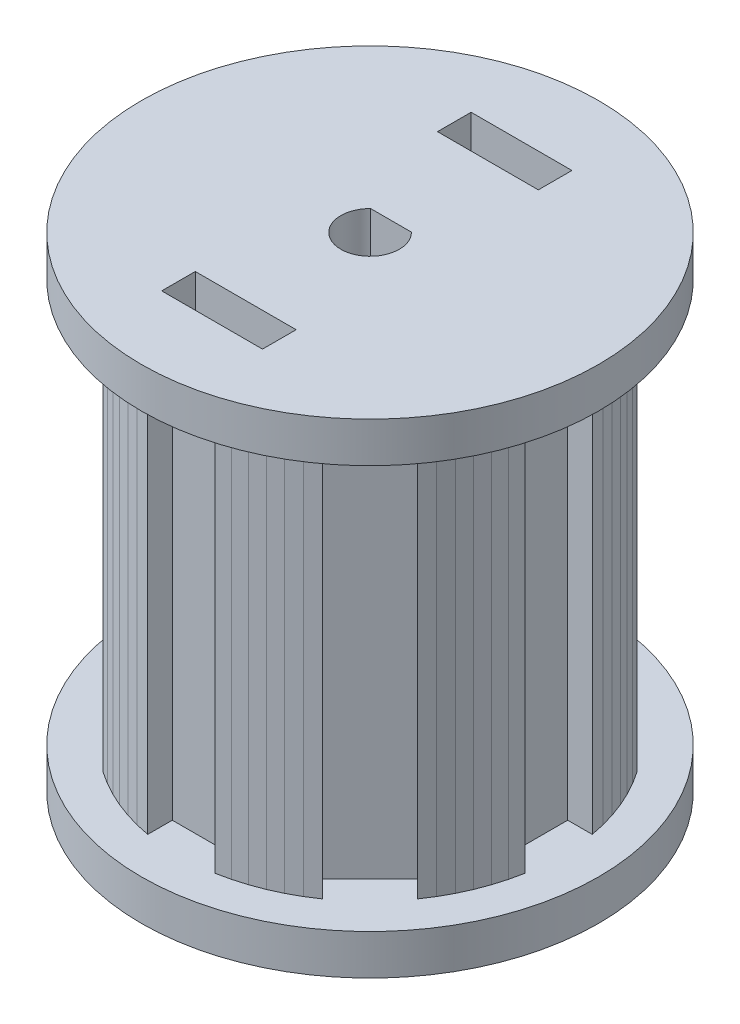
from build123d import *

# Parameters (mm, degrees)
SKETCH1_R           = 17
BOSS_EXTRUDE1_DEPTH = 3
SKETCH3_R           = 17
BOSS_EXTRUDE2_DEPTH = 3
BOSS_EXTRUDE3_DEPTH = 31
SKETCH7_R           = 1.751351815
CUT_EXTRUDE11_DEPTH = 50
CUT_EXTRUDE1_DEPTH  = 50
SKETCH8_W           = 7.5
SKETCH8_H           = 2.5
CUT_EXTRUDE12_DEPTH = 40


with BuildPart() as part:
    # Sketch1 → Boss-Extrude1 (new body)
    with BuildSketch(Plane(origin=(0, -15, 0), x_dir=(1, 0, 0), z_dir=(0, 1, 0))):
        with Locations(Location((0, 0, 0), (0, 0, 270))):
            Circle(SKETCH1_R)
    extrude(amount=BOSS_EXTRUDE1_DEPTH)



with BuildPart() as body_2:
    # Sketch3 → Boss-Extrude2 (new body)
    with BuildSketch(Plane(origin=(0, 21, 0), x_dir=(1, 0, 0), z_dir=(0, 1, 0))):
        with Locations(Location((0, 0, 0), (0, 0, 270))):
            Circle(SKETCH3_R)
    extrude(amount=-BOSS_EXTRUDE2_DEPTH)


with BuildPart() as part_1:
    add(part.part)

    add(body_2.part)  # Boss-Extrude3 merges body 2
    # Sketch6 → Boss-Extrude3 (add)
    with BuildSketch(Plane(origin=(0, -12, 0), x_dir=(1, 0, 0), z_dir=(0, 1, 0))):
        Polygon((-10.39609313, -6.860559341), (-11.68775931, -8.152225055), (-12.244775891, -7.288892753), (-12.738139369, -6.387668662), (-13.165283017, -5.453239195), (-13.523988426, -4.490460269), (-13.812389225, -3.504338907), (-14.028987847, -2.499999944), (-12.202296406, -2.499999944), (-12.202296406, 2.499999944), (-14.028987847, 2.499999944), (-13.812389225, 3.504338907), (-13.523988426, 4.490460269), (-13.165283017, 5.453239195), (-12.738139369, 6.387668662), (-12.244775891, 7.288892753), (-11.68775931, 8.152225055), (-10.39609313, 6.860559341), (-6.860559341, 10.39609313), (-8.152225055, 11.68775931), (-7.288892753, 12.244775891), (-6.387668662, 12.738139369), (-5.453239195, 13.165283017), (-4.490460269, 13.523988426), (-3.504338907, 13.812389225), (-2.499999944, 14.028987847), (-2.499999944, 12.174172863), (2.499999944, 12.202296406), (2.499999944, 14.028987847), (3.504338907, 13.812389225), (4.490460269, 13.523988426), (5.453239195, 13.165283017), (6.387668662, 12.738139369), (7.288892753, 12.244775891), (8.152225055, 11.68775931), (6.860559341, 10.39609313), (10.39609313, 6.860559341), (11.68775931, 8.152225055), (12.244775891, 7.288892753), (12.738139369, 6.387668662), (13.165283017, 5.453239195), (13.523988426, 4.490460269), (13.812389225, 3.504338907), (14.028987847, 2.499999944), (12.202296406, 2.499999944), (12.202296406, -2.499999944), (14.028987847, -2.499999944), (13.812389225, -3.504338907), (13.523988426, -4.490460269), (13.165283017, -5.453239195), (12.738139369, -6.387668662), (12.244775891, -7.288892753), (11.68775931, -8.152225055), (10.39609313, -6.860559341), (6.860559341, -10.39609313), (8.152225055, -11.68775931), (7.288892753, -12.244775891), (6.387668662, -12.738139369), (5.453239195, -13.165283017), (4.490460269, -13.523988426), (3.504338907, -13.812389225), (2.499999944, -14.028987847), (2.499999944, -12.202296406), (-2.499999944, -12.202296406), (-2.499999944, -14.028987847), (-3.504338907, -13.812389225), (-4.490460269, -13.523988426), (-5.453239195, -13.165283017), (-6.387668662, -12.738139369), (-7.288892753, -12.244775891), (-8.152225055, -11.68775931), (-6.860559341, -10.39609313), align=None)
    extrude(amount=BOSS_EXTRUDE3_DEPTH)

    # Sketch7 → Cut-Extrude11 (cut)
    with BuildSketch(Plane(origin=(-0.068553102, 0, -12.187849043), x_dir=(-0.9999841817006155, 0, 0.005624619858302935), z_dir=(-0.005624619858302935, 0, -0.9999841817006155))):
        with Locations((-0.120761258, 16)):
            Circle(SKETCH7_R)
    extrude(amount=-CUT_EXTRUDE11_DEPTH, mode=Mode.SUBTRACT)

    # Sketch2 → Cut-Extrude1 (cut)
    with BuildSketch(Plane(origin=(0, -15, 0), x_dir=(1, 0, 0), z_dir=(0, 1, 0))):
        with BuildLine():
            Line((1.514793699, 1.566442938), (-1.521232282, 1.566442938))
            ThreePointArc((-1.521232282, 1.566442938), (-0.003219291, -2.164389177), (1.514793699, 1.566442938))
        make_face()
    extrude(amount=CUT_EXTRUDE1_DEPTH, mode=Mode.SUBTRACT)

    # Sketch8 → Cut-Extrude12 (cut)
    with BuildSketch(Plane(origin=(0, -15, 0), x_dir=(1, 0, 0), z_dir=(0, 1, 0))):
        with Locations((-0.237061367, 10.255385433)):
            Rectangle(SKETCH8_W, SKETCH8_H)
    cut_extrude12 = extrude(amount=CUT_EXTRUDE12_DEPTH, mode=Mode.SUBTRACT)

    # Mirror1: Cut-Extrude12 across plane
    add(cut_extrude12.mirror(Plane.XY), mode=Mode.SUBTRACT)


solid = part_1.part
